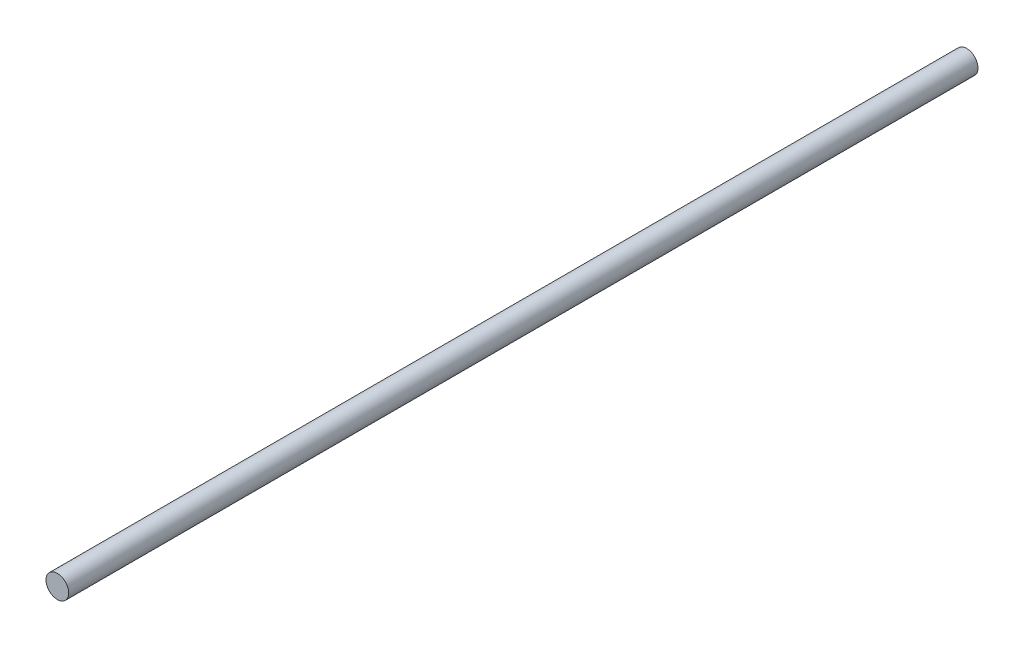
from build123d import *

# Parameters (mm, degrees)
SKETCH1_R           = 6.35
BOSS_EXTRUDE1_DEPTH = 254


with BuildPart() as part:
    # Sketch1 → Boss-Extrude1 (new, symmetric)
    with BuildSketch(Plane.XY):
        Circle(SKETCH1_R)
    extrude(amount=BOSS_EXTRUDE1_DEPTH, both=True)


solid = part.part
